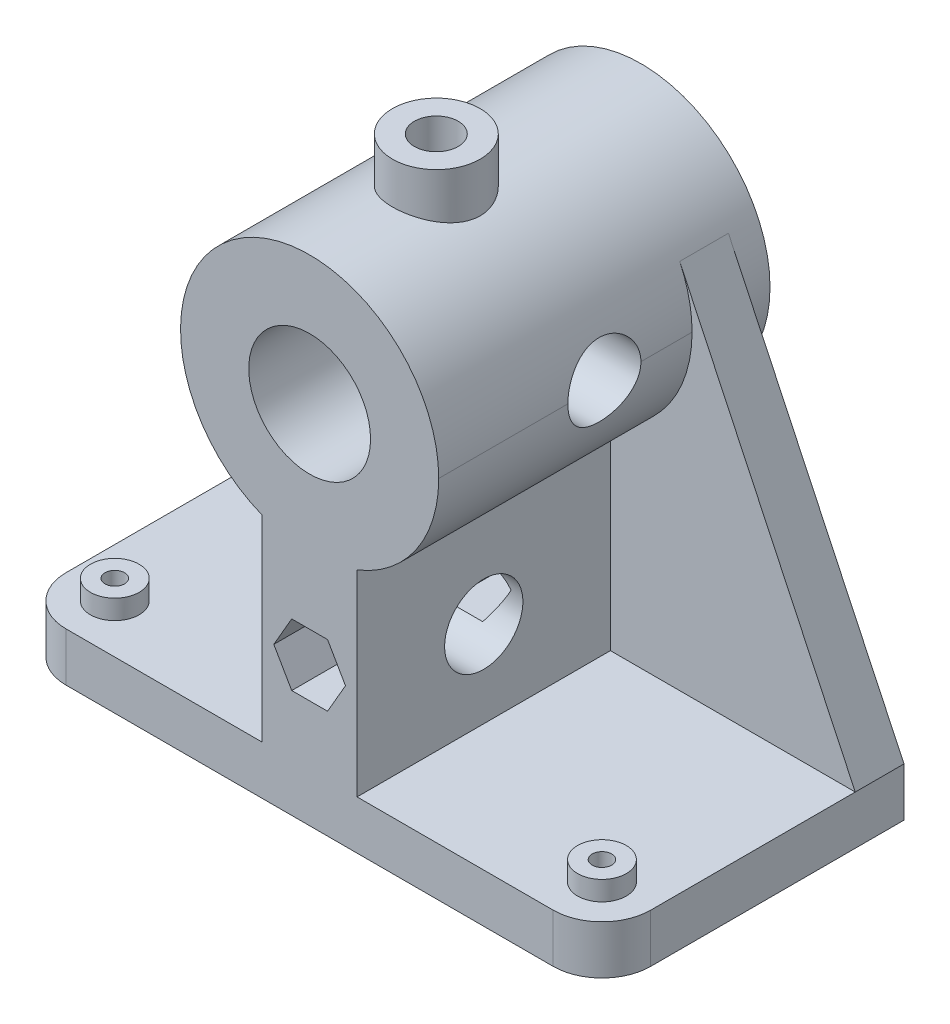
from build123d import *

# Parameters (mm, degrees)
EXTRUDE_1_DEPTH          = 10
EXTRUDE_2_DEPTH          = 26
EXTRUDE_2_DEPTH_BACK     = 42
SKETCH_2_R               = 26.5
SKETCH_3_R               = 12.5
CUT_EXTRUDE_1_DEPTH      = 137.1111678
EXTRUDE_3_DEPTH          = 10
CUT_EXTRUDE_2_DEPTH      = 126.164891244
CUT_EXTRUDE_2_DEPTH_BACK = 126.164891244
SKETCH_5_R               = 7.5
EXTRUDE_4_REACH          = 119.202
EXTRUDE_4_END_RADIUS     = 26.5
SKETCH_6_W               = 19.469052682
SKETCH_6_H               = 52
EXTRUDE_5_REACH          = 134.151
EXTRUDE_5_END_RADIUS     = 26.5
SKETCH_7_R               = 9
CUT_EXTRUDE_3_REACH      = 134.151
CUT_EXTRUDE_3_END_RADIUS = 12.5
SKETCH_8_R               = 4.5
SKETCH_9_R               = 5
EXTRUDE_6_DEPTH          = 4
SKETCH_10_R              = 2
CUT_EXTRUDE_4_DEPTH      = 14
SKETCH_11_R              = 8.033877967
CUT_EXTRUDE_5_DEPTH      = 19.469052682
CUT_EXTRUDE_6_REACH      = 144.562


with BuildPart() as part:
    # 草图1 → 凸台-拉伸1 (new body)
    with BuildSketch(Plane(origin=(0, 0, 0), x_dir=(1, 0, 0), z_dir=(0, 1, 0))):
        with BuildLine():
            Line((-60, 26), (60, 26))
            Line((60, 26), (60, -16))
            ThreePointArc((60, -16), (57.071067812, -23.071067812), (50, -26))
            Line((50, -26), (-50, -26))
            ThreePointArc((-50, -26), (-57.071067812, -23.071067812), (-60, -16))
            Line((-60, -16), (-60, 26))
        make_face()
    extrude(amount=EXTRUDE_1_DEPTH)



with BuildPart() as body_2:
    # 草图2 → 凸台-拉伸2 (new, two sides: drawn at the far end of the back side and taken through both)
    with BuildSketch(Plane.XY.offset(-EXTRUDE_2_DEPTH_BACK)):
        with Locations((0, 75)):
            Circle(SKETCH_2_R)
    extrude(amount=EXTRUDE_2_DEPTH + EXTRUDE_2_DEPTH_BACK)

    # 草图3 → 切除-拉伸1 (cut, through all)
    with BuildSketch(Plane.XY.offset(26)):
        with Locations((0, 75)):
            Circle(SKETCH_3_R)
    extrude(amount=-CUT_EXTRUDE_1_DEPTH, mode=Mode.SUBTRACT)


with BuildPart() as part_1:
    add(part.part)

    add(body_2.part)  # 凸台-拉伸3 merges body 2
    # 草图4 → 凸台-拉伸3 (add)
    with BuildSketch(Plane(origin=(0, 0, -26), x_dir=(-1, 0, 0), z_dir=(0, 0, -1))):
        with BuildLine():
            Line((-60, 10), (-23.962654977, 86.315527671))
            ThreePointArc((-23.962654977, 86.315527671), (0, 48.5), (23.962654977, 86.315527671))
            Line((23.962654977, 86.315527671), (60, 10))
            Line((60, 10), (60, 0))
            Line((60, 0), (-60, 0))
            Line((-60, 0), (-60, 10))
        make_face()
    extrude(amount=EXTRUDE_3_DEPTH)

    # 草图5 → 切除-拉伸2 (cut, two sides: drawn at the far end of the back side and taken through both)
    with BuildSketch(Plane(origin=(0, 0, 0), x_dir=(0, 0, -1), z_dir=(1, 0, 0)).offset(-CUT_EXTRUDE_2_DEPTH_BACK)):
        with Locations((8, 75)):
            Circle(SKETCH_5_R)
    extrude(amount=CUT_EXTRUDE_2_DEPTH + CUT_EXTRUDE_2_DEPTH_BACK, mode=Mode.SUBTRACT)

    # 凸台-拉伸4: up to this cylinder (the profile starts outside it)
    extrude_4_end = Plane(origin=(0, 75, 0), z_dir=(0, 0, 1)) * Cylinder(EXTRUDE_4_END_RADIUS, 292.404, mode=Mode.PRIVATE)
    # 草图6 → 凸台-拉伸4 (add, up to the surface)
    with BuildSketch(Plane(origin=(0, 10, 0), x_dir=(1, 0, 0), z_dir=(0, 1, 0)), mode=Mode.PRIVATE) as extrude_4_sk1:
        Rectangle(SKETCH_6_W, SKETCH_6_H)
    extrude_4_tool1 = extrude(extrude_4_sk1.sketch, amount=EXTRUDE_4_REACH, mode=Mode.PRIVATE) - extrude_4_end
    add(extrude_4_tool1.solids().sort_by_distance((0, 10, 0))[0])

    # 凸台-拉伸5: up to this cylinder (the profile starts outside it)
    extrude_5_end = Plane(origin=(0, 75, 0), z_dir=(0, 0, 1)) * Cylinder(EXTRUDE_5_END_RADIUS, 322.302, mode=Mode.PRIVATE)
    # 草图7 → 凸台-拉伸5 (add, up to the surface)
    with BuildSketch(Plane(origin=(0, 110, 0), x_dir=(1, 0, 0), z_dir=(0, 1, 0)), mode=Mode.PRIVATE) as extrude_5_sk1:
        with Locations(Location((0, 0, 0), (0, 0, 270))):
            Circle(SKETCH_7_R)
    extrude_5_tool1 = extrude(extrude_5_sk1.sketch, amount=-EXTRUDE_5_REACH, mode=Mode.PRIVATE) - extrude_5_end
    add(extrude_5_tool1.solids().sort_by_distance((0, 110, 0))[0])

    # 切除-拉伸3: up to this cylinder (the profile starts outside it)
    cut_extrude_3_end = Plane(origin=(0, 75, 0), z_dir=(0, 0, 1)) * Cylinder(CUT_EXTRUDE_3_END_RADIUS, 294.302, mode=Mode.PRIVATE)
    # 草图8 → 切除-拉伸3 (cut, up to the surface)
    with BuildSketch(Plane(origin=(0, 110, 0), x_dir=(1, 0, 0), z_dir=(0, 1, 0)), mode=Mode.PRIVATE) as cut_extrude_3_sk1:
        with Locations(Location((0, 0, 0), (0, 0, 270))):
            Circle(SKETCH_8_R)
    cut_extrude_3_tool1 = extrude(cut_extrude_3_sk1.sketch, amount=-CUT_EXTRUDE_3_REACH, mode=Mode.PRIVATE) - cut_extrude_3_end
    add(cut_extrude_3_tool1.solids().sort_by_distance((0, 110, 0))[0], mode=Mode.SUBTRACT)

    # 草图9 → 凸台-拉伸6 (add)
    with BuildSketch(Plane(origin=(0, 10, 0), x_dir=(1, 0, 0), z_dir=(0, 1, 0))):
        with Locations(Location((-50, -16, 0), (0, 0, 90))):
            Circle(SKETCH_9_R)
        with Locations(Location((50, -16, 0), (0, 0, 90))):
            Circle(SKETCH_9_R)
    extrude(amount=EXTRUDE_6_DEPTH)

    # 草图10 → 切除-拉伸4 (cut)
    with BuildSketch(Plane(origin=(0, 14, 0), x_dir=(1, 0, 0), z_dir=(0, 1, 0))):
        with Locations(Location((-50, -16, 0), (0, 0, 270))):
            Circle(SKETCH_10_R)
        with Locations(Location((50, -16, 0), (0, 0, 270))):
            Circle(SKETCH_10_R)
    extrude(amount=-CUT_EXTRUDE_4_DEPTH, mode=Mode.SUBTRACT)

    # 草图11 → 切除-拉伸5 (cut)
    with BuildSketch(Plane.ZY.offset(9.734526341)):
        with Locations((0, 27.71124377)):
            Circle(SKETCH_11_R)
    extrude(amount=-CUT_EXTRUDE_5_DEPTH, mode=Mode.SUBTRACT)

    # 切除-拉伸6: up to this face of the body (flat: up to its plane)
    cut_extrude_6_end = Plane(part_1.part.faces().sort_by_distance((0, 27.427001482, -36))[0])
    # 草图12 → 切除-拉伸6 (cut, up to the picked face)
    with BuildSketch(Plane.XY.offset(26), mode=Mode.PRIVATE) as cut_extrude_6_sk1:
        Polygon((7.355489806, 28.573188611), (3.677744903, 34.943229641), (-3.677744903, 34.943229641), (-7.355489806, 28.573188611), (-3.677744903, 22.203147582), (3.677744903, 22.203147582), align=None)
    cut_extrude_6_tool1 = split(extrude(cut_extrude_6_sk1.sketch, amount=-CUT_EXTRUDE_6_REACH, mode=Mode.PRIVATE), bisect_by=cut_extrude_6_end, keep=Keep.BOTH, mode=Mode.PRIVATE)
    add(cut_extrude_6_tool1.solids().sort_by(Axis((0, 28.573189, 26), (0, 0, -1)))[0], mode=Mode.SUBTRACT)


solid = part_1.part
